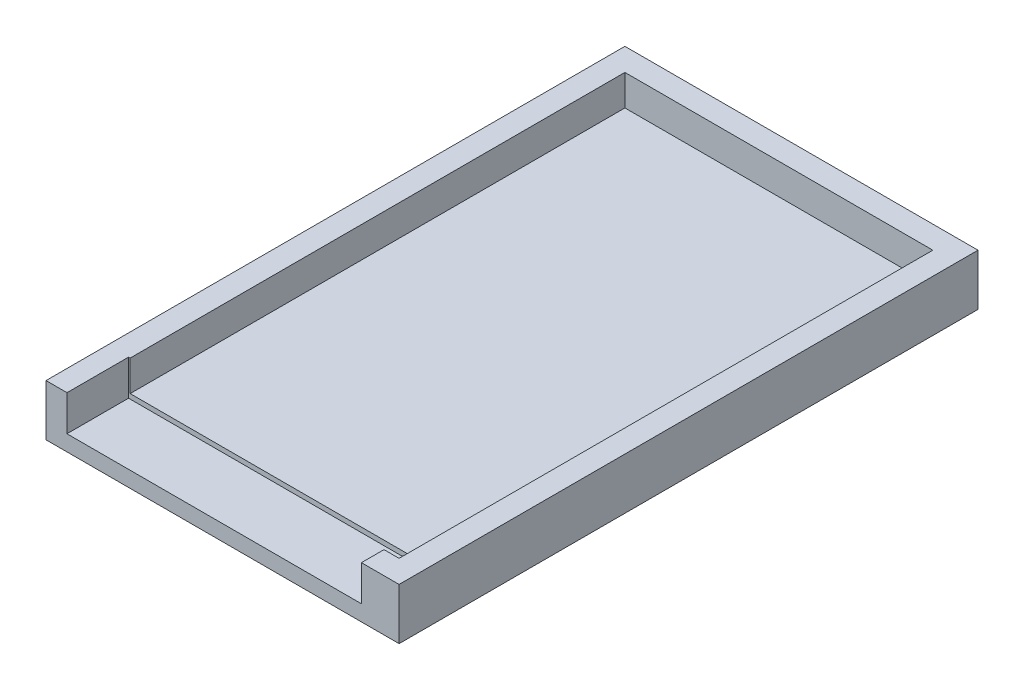
from build123d import *

# Parameters (mm, degrees)
SKETCH2_W           = 30
SKETCH2_H           = 52
BOSS_EXTRUDE1_DEPTH = 2
SKETCH2_3_W         = 34.4
SKETCH2_3_H         = 56.4
SKETCH2_3_W_2       = 30
SKETCH2_3_H_2       = 52
BOSS_EXTRUDE2_DEPTH = 5
SKETCH3_W           = 28.685719202
SKETCH3_H           = 4.374860236
CUT_EXTRUDE1_DEPTH  = 6


with BuildPart() as part:
    # Sketch2 → Boss-Extrude1 (new body)
    with BuildSketch(Plane(origin=(0, 0, 0), x_dir=(1, 0, 0), z_dir=(0, 1, 0))):
        Rectangle(SKETCH2_W, SKETCH2_H)
    extrude(amount=BOSS_EXTRUDE1_DEPTH)

    # Sketch2<3> → Boss-Extrude2 (add)
    with BuildSketch(Plane(origin=(0, 0, 0), x_dir=(1, 0, 0), z_dir=(0, 1, 0))):
        Rectangle(SKETCH2_3_W, SKETCH2_3_H)
        Rectangle(SKETCH2_3_W_2, SKETCH2_3_H_2, mode=Mode.SUBTRACT)
    extrude(amount=BOSS_EXTRUDE2_DEPTH)

    # Sketch3 → Cut-Extrude1 (cut)
    with BuildSketch(Plane.XY.offset(28.2)):
        with Locations((-0.813326627, 3.719763482)):
            Rectangle(SKETCH3_W, SKETCH3_H)
    extrude(amount=-CUT_EXTRUDE1_DEPTH, mode=Mode.SUBTRACT)


solid = part.part
